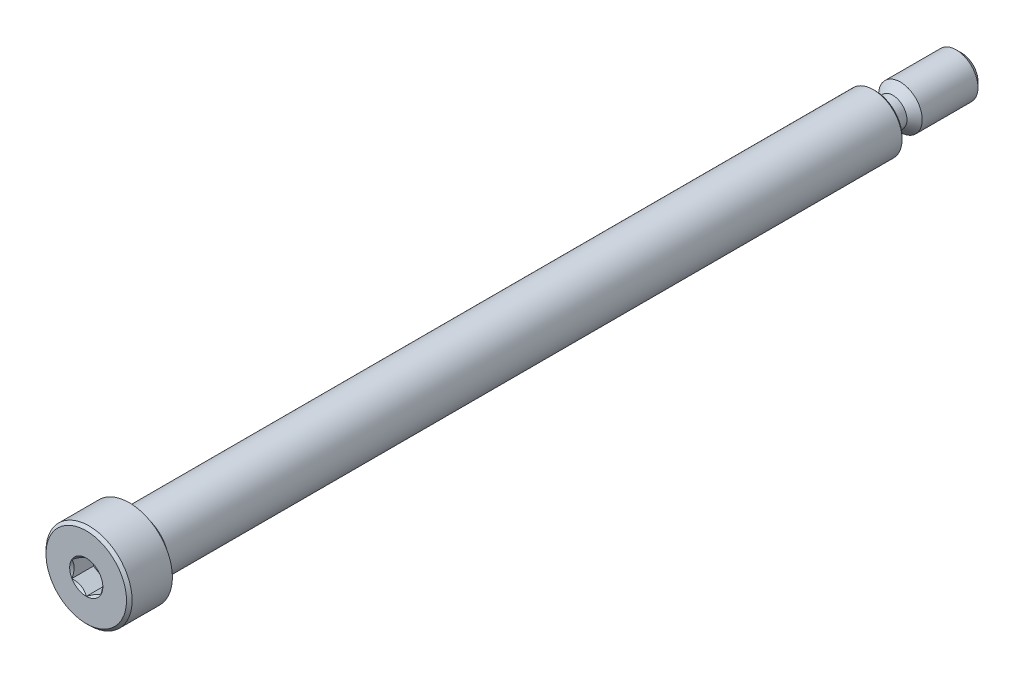
from build123d import *

# Parameters (mm, degrees)
SKETCH12_R          = 2.413
BOSS_EXTRUDE1_DEPTH = 9.525
CHAMFER1_SIZE       = 0.60325
CHAMFER2_SIZE       = 0.3095625
FILLET1_R           = 0.264583333
CUT_EXTRUDE2_DEPTH  = 2.38125


with BuildPart() as part:
    # Sketch13 → Revolve1 (revolve)
    with BuildSketch(Plane(origin=(0, 0, 0), x_dir=(0, 0, -1), z_dir=(1, 0, 0)), mode=Mode.PRIVATE) as revolve1_sk:
        Polygon((0, 0), (0, 4.7625), (4.7625, 4.7625), (4.7625, 2.936875), (5.715, 2.936875), (5.953125, 3.175), (87.074375, 3.175), (87.3125, 2.936875), (87.3125, 0), align=None)
    revolve(revolve1_sk.sketch.rotate(Axis((0, 0, -87.3125), (0, 0, 1)), 90), axis=Axis((0, 0, -87.3125), (0, 0, 1)))

    # Sketch12 → Boss-Extrude1 (add)
    with BuildSketch(Plane(origin=(0, 0, -87.3125), x_dir=(-1, 0, 0), z_dir=(0, 0, -1))):
        Circle(SKETCH12_R)
    extrude(amount=BOSS_EXTRUDE1_DEPTH)

    # Sketch5 → Cut-Revolve1 (revolve, cut)
    with BuildSketch(Plane(origin=(0, 0, 0), x_dir=(0, 0, -1), z_dir=(1, 0, 0))):
        Polygon((87.3125, 2.413), (90.06205, 2.413), (89.2175, 1.56845), (87.3125, 1.56845), align=None)
    revolve(axis=Axis((0, 0, -87.3125), (0, 0, 1)), mode=Mode.SUBTRACT)

    # Chamfer1
    chamfer1_edges = [part.edges().sort_by_distance(p)[0] for p in [
        (2.413, 0, -96.8375),
    ]]
    chamfer(chamfer1_edges, length=CHAMFER1_SIZE)

    # Chamfer2
    chamfer2_edges = [part.edges().sort_by_distance(p)[0] for p in [
        (4.7625, 0, 0),
    ]]
    chamfer(chamfer2_edges, length=CHAMFER2_SIZE)

    # Fillet1
    fillet1_edges = [part.edges().sort_by_distance(p)[0] for p in [
        (0, -1.56845, -87.3125),
    ]]
    fillet(fillet1_edges, radius=FILLET1_R)

    # Sketch8 → Cut-Extrude2 (cut)
    with BuildSketch(Plane.XY):
        Polygon((1.5875, 0.916543552), (0, 1.833087105), (-1.5875, 0.916543552), (-1.5875, -0.916543552), (0, -1.833087105), (1.5875, -0.916543552), align=None)
    extrude(amount=-CUT_EXTRUDE2_DEPTH, mode=Mode.SUBTRACT)

    # Cut-Extrude4 cone 1 section (through the dimple's axis) → Cut-Extrude4 (revolve, cut)
    with BuildSketch(Plane(origin=(0, 0, 0), x_dir=(0, -1, 0), z_dir=(1, 0, 0))):
        Polygon((0, 0), (1.833087105, 0), (0, 1.833087105), align=None)
    revolve(axis=Axis((0, 0, 0), (0, 0, -1)), mode=Mode.SUBTRACT)


solid = part.part
